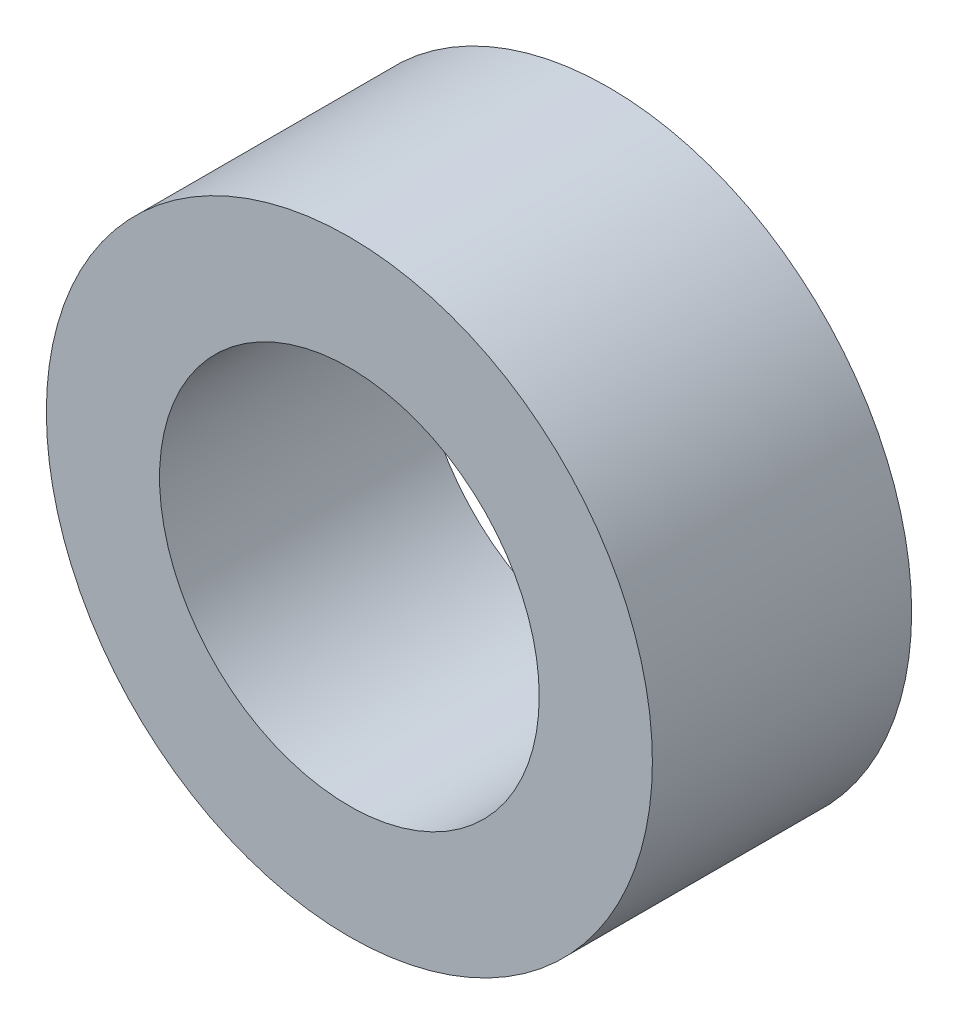
from build123d import *

# Parameters (mm, degrees)
SKETCH_1_R      = 9
SKETCH_1_R_2    = 5.638409967
EXTRUDE_1_DEPTH = 7.7


with BuildPart() as part:
    # Эскиз1 → Бобышка-Вытянуть1 (new body)
    with BuildSketch(Plane.XY):
        Circle(SKETCH_1_R)
        Circle(SKETCH_1_R_2, mode=Mode.SUBTRACT)
    extrude(amount=-EXTRUDE_1_DEPTH)


solid = part.part
